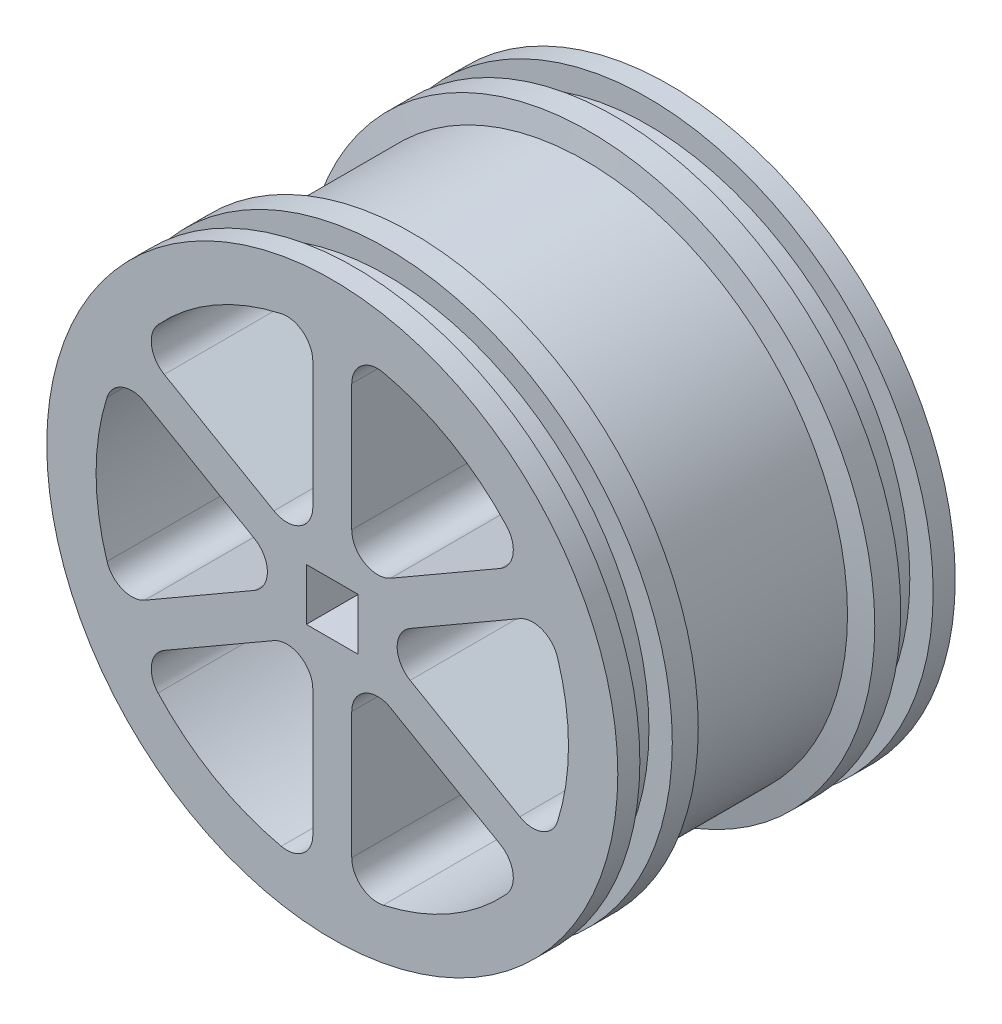
from build123d import *

# Parameters (mm, degrees)
SKETCH2_W               = 3
SKETCH2_H               = 18.2
BOSS_EXTRUDE1_DEPTH     = 26
CIRPATTERN1_COUNT       = 6
CUT_EXTRUDE1_DEPTH      = 41.546269865
CUT_EXTRUDE1_DEPTH_BACK = 41.546269865
SKETCH3_W               = 4
SKETCH3_H               = 4
FILLET1_R               = 2


with BuildPart() as part:
    # Sketch1 → Revolve1 (revolve)
    with BuildSketch(Plane(origin=(0, 0, 0), x_dir=(0, 0, -1), z_dir=(1, 0, 0)), mode=Mode.PRIVATE) as revolve1_sk:
        Polygon((0, 22), (1.7, 22), (1.7, 20.2), (4.2, 20.2), (4.2, 22), (6.2, 22), (6.5, 20.2), (19.5, 20.2), (19.8, 22), (21.8, 22), (21.8, 20.2), (24.3, 20.2), (24.3, 22), (26, 22), (26, 18.2), (0, 18.2), align=None)
    revolve(revolve1_sk.sketch.rotate(Axis((0, 0, 0.322174052), (0, 0, -1)), 90), axis=Axis((0, 0, 0.322174052), (0, 0, -1)))

    # Sketch2 → Boss-Extrude1 (add)
    with BuildSketch(Plane.XY):
        with Locations((0, 9.1)):
            Rectangle(SKETCH2_W, SKETCH2_H)
    boss_extrude1 = extrude(amount=-BOSS_EXTRUDE1_DEPTH)

    # CirPattern1: Boss-Extrude1 ×6 about axis
    cirpattern1_axis = Axis((0, 0, 0), (0, 0, 1))
    for i in range(1, CIRPATTERN1_COUNT):
        add(boss_extrude1.rotate(cirpattern1_axis, i * 360 / CIRPATTERN1_COUNT))

    # Sketch3 → Cut-Extrude1 (cut, two sides: drawn at the far end of the back side and taken through both)
    with BuildSketch(Plane.XY.offset(-CUT_EXTRUDE1_DEPTH_BACK)):
        Rectangle(SKETCH3_W, SKETCH3_H)
    extrude(amount=CUT_EXTRUDE1_DEPTH + CUT_EXTRUDE1_DEPTH_BACK, mode=Mode.SUBTRACT)

    # Fillet1
    fillet1_edges = [part.edges().sort_by_distance(p)[0] for p in [
        (3, 0, -13),
        (1.5, -2.598076211, -13),
        (-1.5, -2.598076211, -13),
        (-3, 0, -13),
        (16.458039343, 7.770002637, -13),
        (14.958039343, 10.368078849, -13),
        (16.458039343, -7.770002637, -13),
        (14.958039343, -10.368078849, -13),
        (-14.958039343, 10.368078849, -13),
        (-1.5, -18.138081486, -13),
        (1.5, -18.138081486, -13),
        (-16.458039343, -7.770002637, -13),
        (-14.958039343, -10.368078849, -13),
        (-16.458039343, 7.770002637, -13),
        (1.5, 18.138081486, -13),
        (-1.5, 18.138081486, -13),
        (-1.5, 2.598076211, -13),
        (1.5, 2.598076211, -13),
    ]]
    fillet(fillet1_edges, radius=FILLET1_R)


solid = part.part
